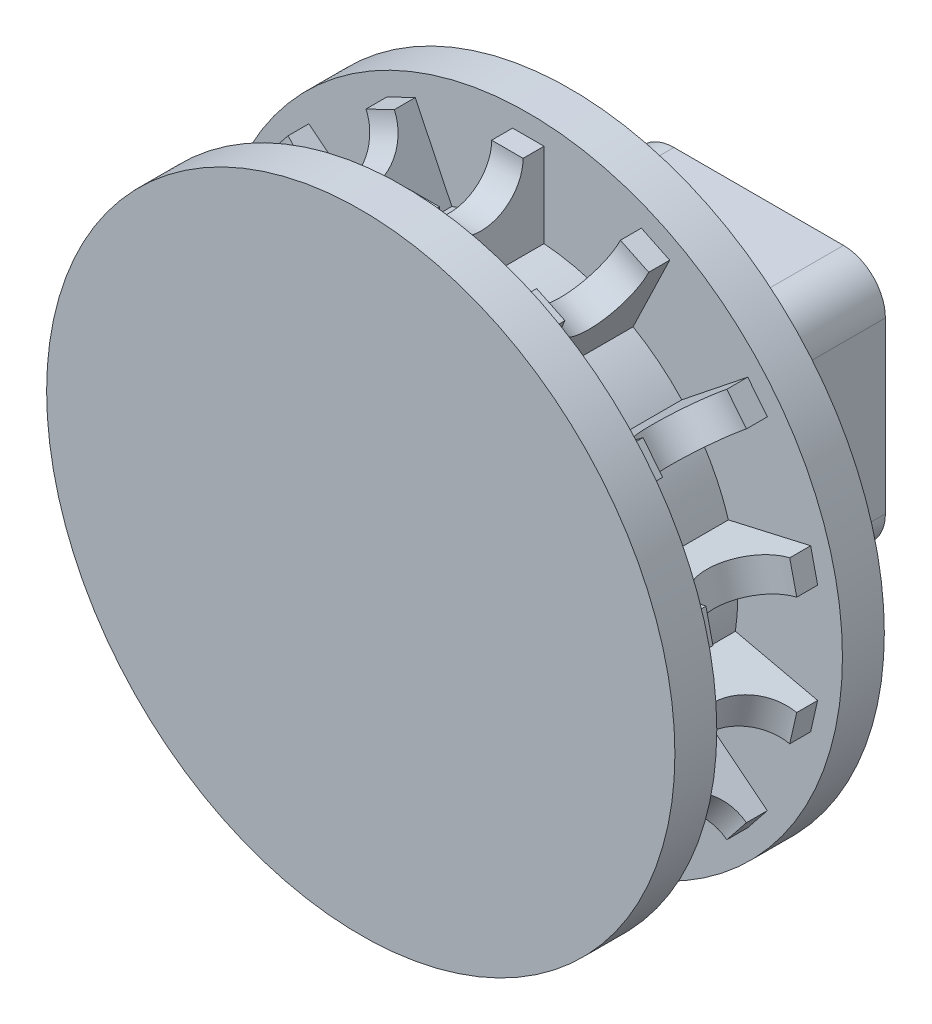
from build123d import *

# Parameters (mm, degrees)
EXTRUDE_1_DEPTH          = 0.75
PATTERN_CIRCULAR_1_COUNT = 14
SKETCH_3_W               = 6.1
SKETCH_3_H               = 6.1
EXTRUDE_2_DEPTH          = 9
FILLET_1_R               = 2
CHAMFER_1_SIZE           = 0.2
CHAMFER_1_SIZE2          = 2.286010461


with BuildPart() as part:
    # 草圖1 → 旋轉1 (revolve)
    with BuildSketch(Plane(origin=(0, 0, 0), x_dir=(0, 0, -1), z_dir=(1, 0, 0))):
        Polygon((-5, 0), (5, 0), (5, 15), (3, 15), (3, 10), (-3, 10), (-3, 15), (-5, 15), align=None)
    revolve(axis=Axis((0, 0, 5), (0, 0, -1)))

    # 草圖2 → 填料-伸長1 (add, symmetric)
    with BuildSketch(Plane(origin=(0, 0, 0), x_dir=(0, 0, -1), z_dir=(1, 0, 0))):
        with BuildLine():
            Line((3, 10), (3, 14))
            Line((3, 14), (2, 14))
            ThreePointArc((2, 14), (0, 12), (-2, 14))
            Line((-2, 14), (-3, 14))
            Line((-3, 14), (-3, 10))
            Line((-3, 10), (-3, 8.5))
            Line((-3, 8.5), (3, 8.5))
            Line((3, 8.5), (3, 10))
        make_face()
    extrude_1 = extrude(amount=EXTRUDE_1_DEPTH, both=True)

    # 環狀複製排列1: 填料-伸長1 ×14 about axis
    pattern_circular_1_axis = Axis((0, 0, 5.5), (0, 0, -1))
    for i in range(1, PATTERN_CIRCULAR_1_COUNT):
        add(extrude_1.rotate(pattern_circular_1_axis, i * 360 / PATTERN_CIRCULAR_1_COUNT))

    # 草圖3 → 填料-伸長2 (add)
    with BuildSketch(Plane(origin=(0, 0, -5), x_dir=(-1, 0, 0), z_dir=(0, 0, -1))):
        with BuildLine():
            Line((-4.05, -6.05), (4.05, -6.05))
            ThreePointArc((4.05, -6.05), (5.464213562, -5.464213562), (6.05, -4.05))
            Line((6.05, -4.05), (6.05, 4.05))
            ThreePointArc((6.05, 4.05), (5.464213562, 5.464213562), (4.05, 6.05))
            Line((4.05, 6.05), (-4.05, 6.05))
            ThreePointArc((-4.05, 6.05), (-5.464213562, 5.464213562), (-6.05, 4.05))
            Line((-6.05, 4.05), (-6.05, -4.05))
            ThreePointArc((-6.05, -4.05), (-5.464213562, -5.464213562), (-4.05, -6.05))
        make_face()
        Rectangle(SKETCH_3_W, SKETCH_3_H, mode=Mode.SUBTRACT)
    extrude(amount=EXTRUDE_2_DEPTH)

    # 圓角1
    fillet_1_edges = [part.edges().sort_by_distance(p)[0] for p in [
        (0, 6.05, -5),
        (-5.464213562, 5.464213562, -5),
        (-6.05, 0, -5),
        (-5.464213562, -5.464213562, -5),
        (0, -6.05, -5),
        (5.464213562, -5.464213562, -5),
        (6.05, 0, -5),
        (5.464213562, 5.464213562, -5),
    ]]
    fillet(fillet_1_edges, radius=FILLET_1_R)

    # 導角1
    chamfer_1_edges = [part.edges().sort_by_distance(p)[0] for p in [
        (0, -3.05, -14),
        (-3.05, 0, -14),
        (0, 3.05, -14),
        (3.05, 0, -14),
    ]]
    chamfer_1_side = [part.faces().sort_by_distance(p)[0] for p in [
        (5.343213562, -5.343213562, -14),
    ]]
    chamfer(chamfer_1_edges, length=CHAMFER_1_SIZE, length2=CHAMFER_1_SIZE2, reference=chamfer_1_side[0])


solid = part.part
